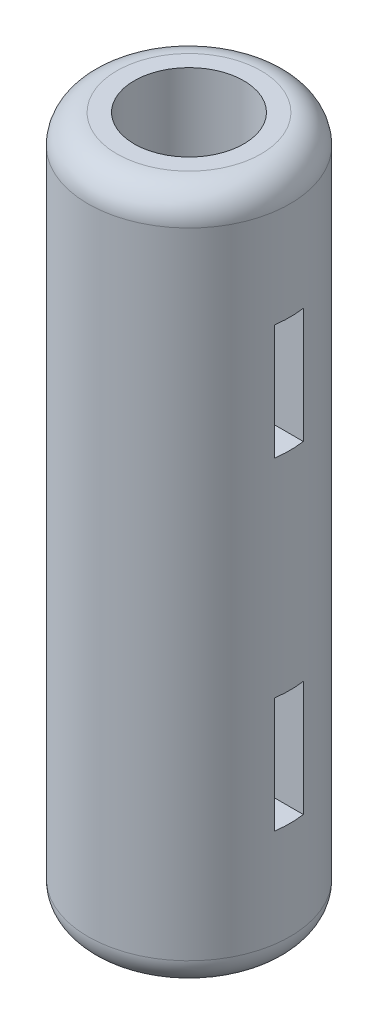
from build123d import *

# Parameters (mm, degrees)
SKETCH3_R               = 35
SKETCH3_R_2             = 19
BOSS_EXTRUDE2_DEPTH     = 240
CUT_EXTRUDE2_DEPTH      = 246.051015097
CUT_EXTRUDE2_DEPTH_BACK = 246.051015097
SKETCH5_W               = 10
SKETCH5_H               = 40
CUT_EXTRUDE3_DEPTH      = 246.051015097
CUT_EXTRUDE3_DEPTH_BACK = 246.051015097
SKETCH6_W               = 10
SKETCH6_H               = 40
FILLET2_R               = 10
FILLET3_R               = 10


with BuildPart() as part:
    # Sketch3 → Boss-Extrude2 (new body)
    with BuildSketch(Plane(origin=(0, 0, 0), x_dir=(1, 0, 0), z_dir=(0, 1, 0))):
        with Locations(Location((0, 0, 0), (0, 0, 270))):
            Circle(SKETCH3_R)
        with Locations(Location((0, 0, 0), (0, 0, 270))):
            Circle(SKETCH3_R_2, mode=Mode.SUBTRACT)
    extrude(amount=BOSS_EXTRUDE2_DEPTH)

    # Sketch5 → Cut-Extrude2 (cut, two sides: drawn at the far end of the back side and taken through both)
    with BuildSketch(Plane(origin=(0, 0, 0), x_dir=(0, 0, -1), z_dir=(1, 0, 0)).offset(-CUT_EXTRUDE2_DEPTH_BACK)):
        with Locations((0, 176)):
            Rectangle(SKETCH5_W, SKETCH5_H)
    extrude(amount=CUT_EXTRUDE2_DEPTH + CUT_EXTRUDE2_DEPTH_BACK, mode=Mode.SUBTRACT)

    # Sketch6 → Cut-Extrude3 (cut, two sides: drawn at the far end of the back side and taken through both)
    with BuildSketch(Plane(origin=(0, 0, 0), x_dir=(0, 0, -1), z_dir=(1, 0, 0)).offset(-CUT_EXTRUDE3_DEPTH_BACK)):
        with Locations((0, 64)):
            Rectangle(SKETCH6_W, SKETCH6_H)
    extrude(amount=CUT_EXTRUDE3_DEPTH + CUT_EXTRUDE3_DEPTH_BACK, mode=Mode.SUBTRACT)

    # Fillet2
    fillet2_edges = [part.edges().sort_by_distance(p)[0] for p in [
        (0, 240, -35),
    ]]
    fillet(fillet2_edges, radius=FILLET2_R)

    # Fillet3
    fillet3_edges = [part.edges().sort_by_distance(p)[0] for p in [
        (0, 0, -35),
    ]]
    fillet(fillet3_edges, radius=FILLET3_R)


solid = part.part
